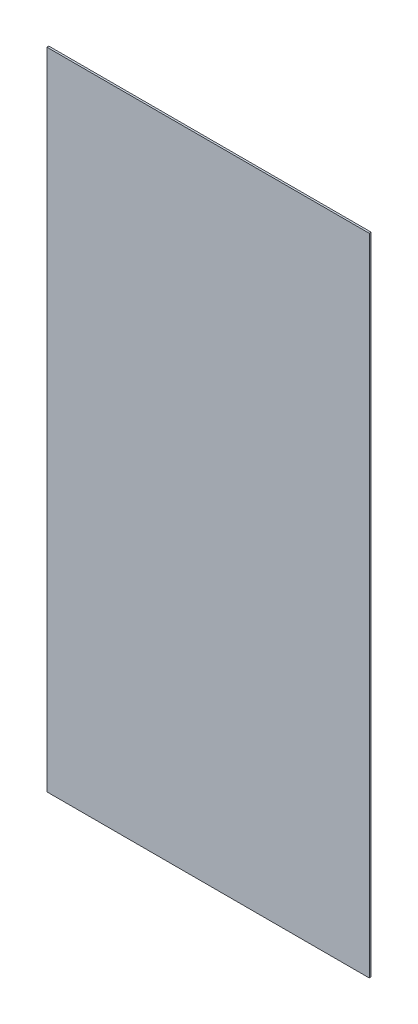
from build123d import *

# Parameters (mm, degrees)
SKETCH1_W           = 500
SKETCH1_H           = 1000
BOSS_EXTRUDE1_DEPTH = 3


with BuildPart() as part:
    # Sketch1 → Boss-Extrude1 (new body)
    with BuildSketch(Plane.XY):
        Rectangle(SKETCH1_W, SKETCH1_H)
    extrude(amount=BOSS_EXTRUDE1_DEPTH)


solid = part.part
